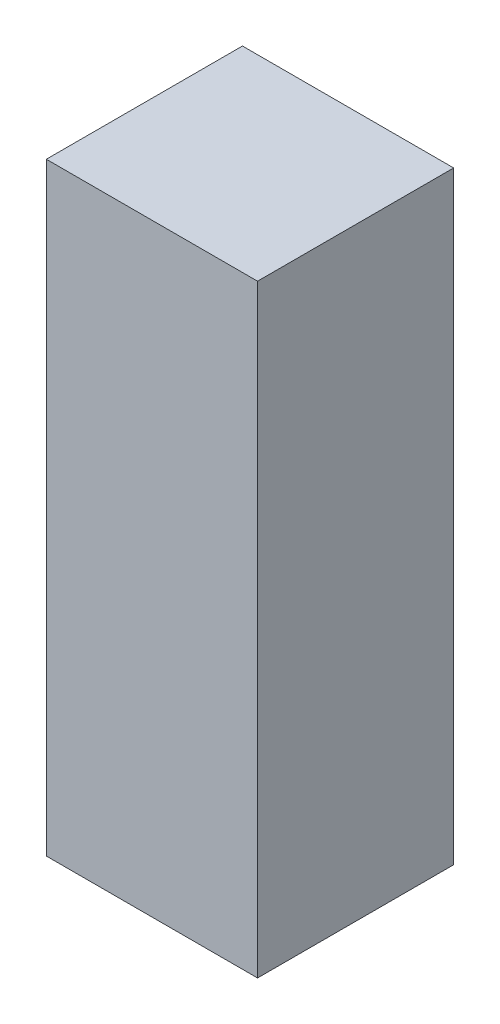
from build123d import *

# Parameters (mm, degrees)
OVEN_PANO_KAPAGI_MENTESE_2_1_START = 20
SKETCH1_W                          = 14
SKETCH1_H                          = 40
OVEN_PANO_KAPAGI_MENTESE_2_1_DEPTH = 13


with BuildPart() as part:
    # Sketch1 → OVEN_pano_kapagi_mentese_2_1 (new body)
    with BuildSketch(Plane.XY.offset(OVEN_PANO_KAPAGI_MENTESE_2_1_START)):
        with Locations((31, 260)):
            Rectangle(SKETCH1_W, SKETCH1_H)
    extrude(amount=OVEN_PANO_KAPAGI_MENTESE_2_1_DEPTH)


solid = part.part
